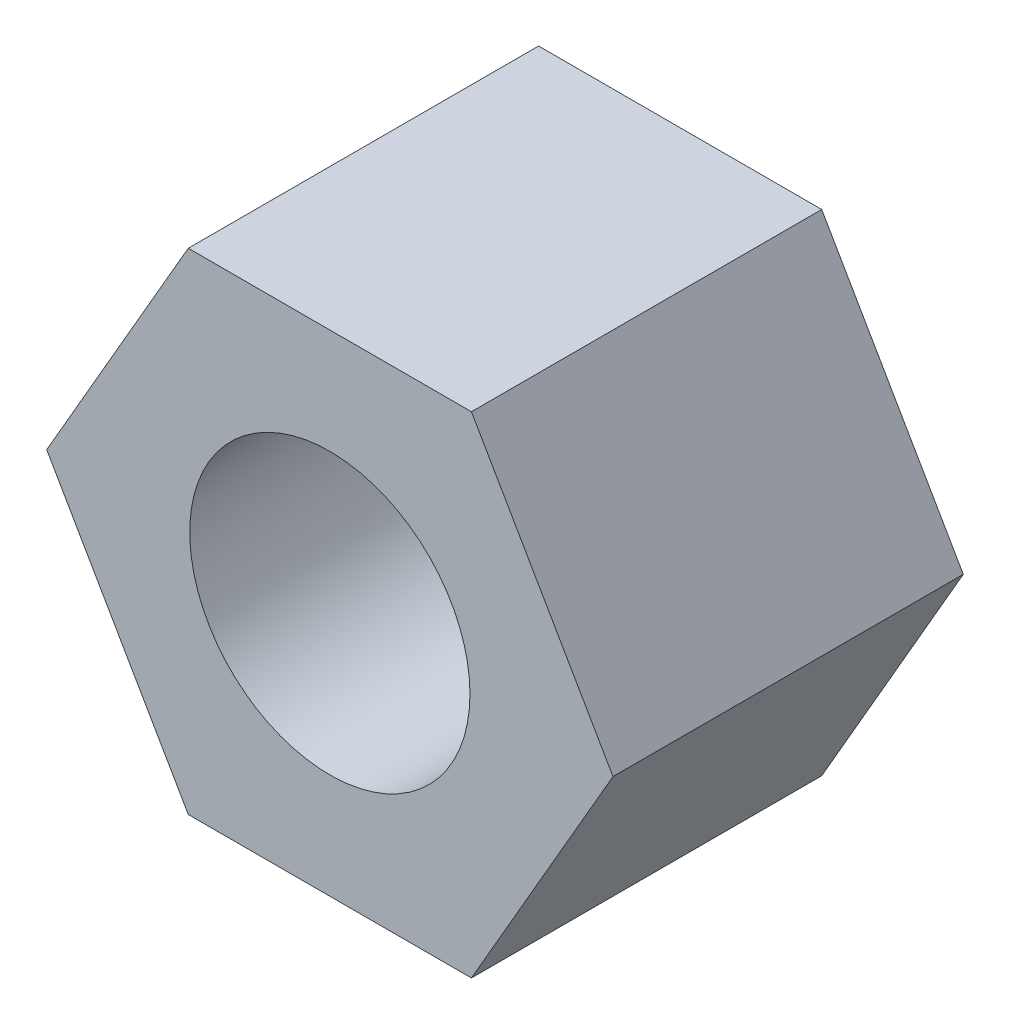
from build123d import *

# Parameters (mm, degrees)
ACROSS_FLATS_7_R                   = 2
NUT_THREAD_ENVELOPE_HEIGHT_5_DEPTH = 5


with BuildPart() as part:
    # Across_flats_7 → Nut_thread_envelope_height_5 (new body)
    with BuildSketch(Plane.XY):
        Polygon((4.041451884, 0), (2.020725942, 3.5), (-2.020725942, 3.5), (-4.041451884, 0), (-2.020725942, -3.5), (2.020725942, -3.5), align=None)
        Circle(ACROSS_FLATS_7_R, mode=Mode.SUBTRACT)
    extrude(amount=NUT_THREAD_ENVELOPE_HEIGHT_5_DEPTH)


solid = part.part
